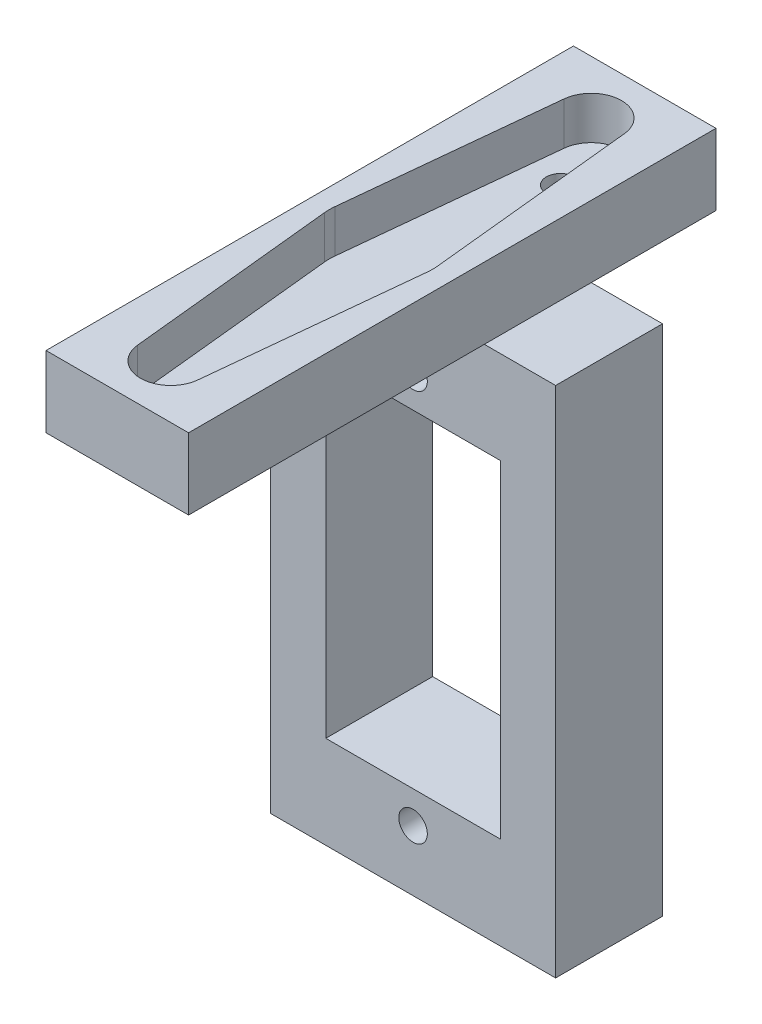
from build123d import *

# Parameters (mm, degrees)
SKETCH_1_W          = 10
SKETCH_1_H          = 37
EXTRUDE_1_DEPTH     = 5
CUT_EXTRUDE_1_DEPTH = 3
SKETCH_3_W          = 20
SKETCH_3_H          = 7.5
EXTRUDE_2_DEPTH     = 36
SKETCH_6_W          = 12.25
SKETCH_6_H          = 23
CUT_EXTRUDE_2_DEPTH = 48.027252737
CUT_EXTRUDE_3_REACH = 45.431
SKETCH_7_R          = 1
CUT_EXTRUDE_4_REACH = 52.784
SKETCH_9_R          = 1


with BuildPart() as part:
    # 草图1 → 凸台-拉伸1 (new body)
    with BuildSketch(Plane(origin=(0, 0, 0), x_dir=(1, 0, 0), z_dir=(0, 1, 0))):
        Rectangle(SKETCH_1_W, SKETCH_1_H)
    extrude(amount=-EXTRUDE_1_DEPTH)

    # 草图2 → 切除-拉伸1 (cut)
    with BuildSketch(Plane(origin=(0, 0, 0), x_dir=(1, 0, 0), z_dir=(0, 1, 0))):
        with BuildLine():
            Line((-2.113983221, 14.966101695), (-3.606206671, 0.368644068))
            ThreePointArc((-3.606206671, 0.368644068), (-3.625, 0), (-3.606206671, -0.368644068))
            Line((-3.606206671, -0.368644068), (-2.113983221, -14.966101695))
            ThreePointArc((-2.113983221, -14.966101695), (0, -16.875), (2.113983221, -14.966101695))
            Line((2.113983221, -14.966101695), (3.606206671, -0.368644068))
            ThreePointArc((3.606206671, -0.368644068), (3.625, 0), (3.606206671, 0.368644068))
            Line((3.606206671, 0.368644068), (2.113983221, 14.966101695))
            ThreePointArc((2.113983221, 14.966101695), (0, 16.875), (-2.113983221, 14.966101695))
        make_face()
    extrude(amount=-CUT_EXTRUDE_1_DEPTH, mode=Mode.SUBTRACT)

    # 草图3 → 凸台-拉伸2 (add)
    with BuildSketch(Plane.XZ.offset(5)):
        with Locations((0, -6)):
            Rectangle(SKETCH_3_W, SKETCH_3_H)
    extrude(amount=EXTRUDE_2_DEPTH)

    # 草图6 → 切除-拉伸2 (cut, through all)
    with BuildSketch(Plane.XY.offset(-2.25)):
        with Locations((0, -23)):
            Rectangle(SKETCH_6_W, SKETCH_6_H)
    extrude(amount=-CUT_EXTRUDE_2_DEPTH, mode=Mode.SUBTRACT)

    # 草图7 → 切除-拉伸3 (cut, up to next)
    with BuildSketch(Plane(origin=(0, -3, 0), x_dir=(1, 0, 0), z_dir=(0, 1, 0)), mode=Mode.PRIVATE) as cut_extrude_3_sk1:
        with Locations(Location((0, 12.6, 0), (0, 0, 270))):
            Circle(SKETCH_7_R)
    cut_extrude_3_tool1 = extrude(cut_extrude_3_sk1.sketch, amount=-CUT_EXTRUDE_3_REACH, mode=Mode.PRIVATE) & part.part
    # 草图7 → 切除-拉伸3 (cut, up to next)
    with BuildSketch(Plane(origin=(0, -3, 0), x_dir=(1, 0, 0), z_dir=(0, 1, 0)), mode=Mode.PRIVATE) as cut_extrude_3_sk2:
        with Locations(Location((0, -12.6, 0), (0, 0, 270))):
            Circle(SKETCH_7_R)
    cut_extrude_3_tool2 = extrude(cut_extrude_3_sk2.sketch, amount=-CUT_EXTRUDE_3_REACH, mode=Mode.PRIVATE) & part.part
    add(cut_extrude_3_tool1.solids().sort_by_distance((0, -3, -12.6))[0], mode=Mode.SUBTRACT)
    add(cut_extrude_3_tool2.solids().sort_by_distance((0, -3, 12.6))[0], mode=Mode.SUBTRACT)

    # 草图9 → 切除-拉伸4 (cut, up to next)
    with BuildSketch(Plane(origin=(0, 0, -9.75), x_dir=(-1, 0, 0), z_dir=(0, 0, -1)), mode=Mode.PRIVATE) as cut_extrude_4_sk1:
        with Locations((0, -9.25)):
            Circle(SKETCH_9_R)
    cut_extrude_4_tool1 = extrude(cut_extrude_4_sk1.sketch, amount=-CUT_EXTRUDE_4_REACH, mode=Mode.PRIVATE) & part.part
    # 草图9 → 切除-拉伸4 (cut, up to next)
    with BuildSketch(Plane(origin=(0, 0, -9.75), x_dir=(-1, 0, 0), z_dir=(0, 0, -1)), mode=Mode.PRIVATE) as cut_extrude_4_sk2:
        with Locations((0, -36.75)):
            Circle(SKETCH_9_R)
    cut_extrude_4_tool2 = extrude(cut_extrude_4_sk2.sketch, amount=-CUT_EXTRUDE_4_REACH, mode=Mode.PRIVATE) & part.part
    add(cut_extrude_4_tool1.solids().sort_by_distance((0, -9.25, -9.75))[0], mode=Mode.SUBTRACT)
    add(cut_extrude_4_tool2.solids().sort_by_distance((0, -36.75, -9.75))[0], mode=Mode.SUBTRACT)


solid = part.part
